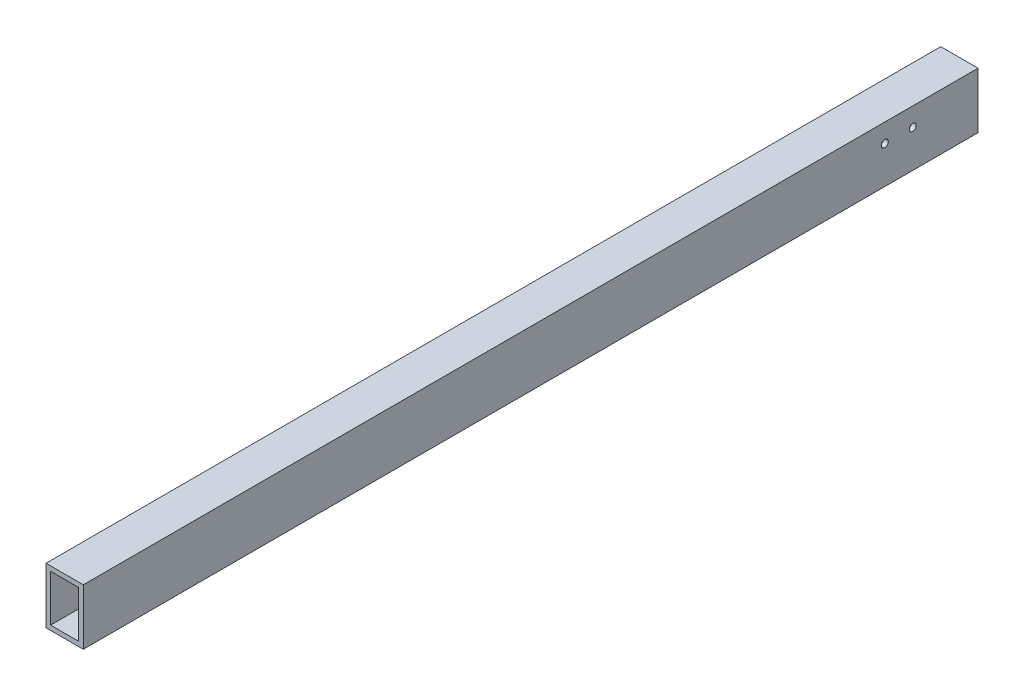
from build123d import *

# Parameters (mm, degrees)
SKETCH1_W           = 25.4
SKETCH1_H           = 38.1
BOSS_EXTRUDE1_DEPTH = 609.6
SHELL1_T            = -3.175
SKETCH2_R           = 2.38125
CUT_EXTRUDE1_DEPTH  = 611.426262951


with BuildPart() as part:
    # Sketch1 → Boss-Extrude1 (new body)
    with BuildSketch(Plane.XY):
        Rectangle(SKETCH1_W, SKETCH1_H)
    extrude(amount=BOSS_EXTRUDE1_DEPTH)

    # Shell1
    shell1_openings = [part.faces().sort_by_distance(p)[0] for p in [
        (0, 0, 609.6),
        (0, 0, 0),
    ]]
    offset(amount=SHELL1_T, openings=shell1_openings, kind=Kind.INTERSECTION)

    # Sketch2 → Cut-Extrude1 (cut, through all)
    with BuildSketch(Plane(origin=(12.7, 0, 0), x_dir=(0, 0, -1), z_dir=(1, 0, 0))):
        with Locations(Location((-44.45, 6.35, 0), (0, 0, 90))):
            Circle(SKETCH2_R)
        with Locations(Location((-63.5, 6.35, 0), (0, 0, 90))):
            Circle(SKETCH2_R)
    extrude(amount=-CUT_EXTRUDE1_DEPTH, mode=Mode.SUBTRACT)


solid = part.part
